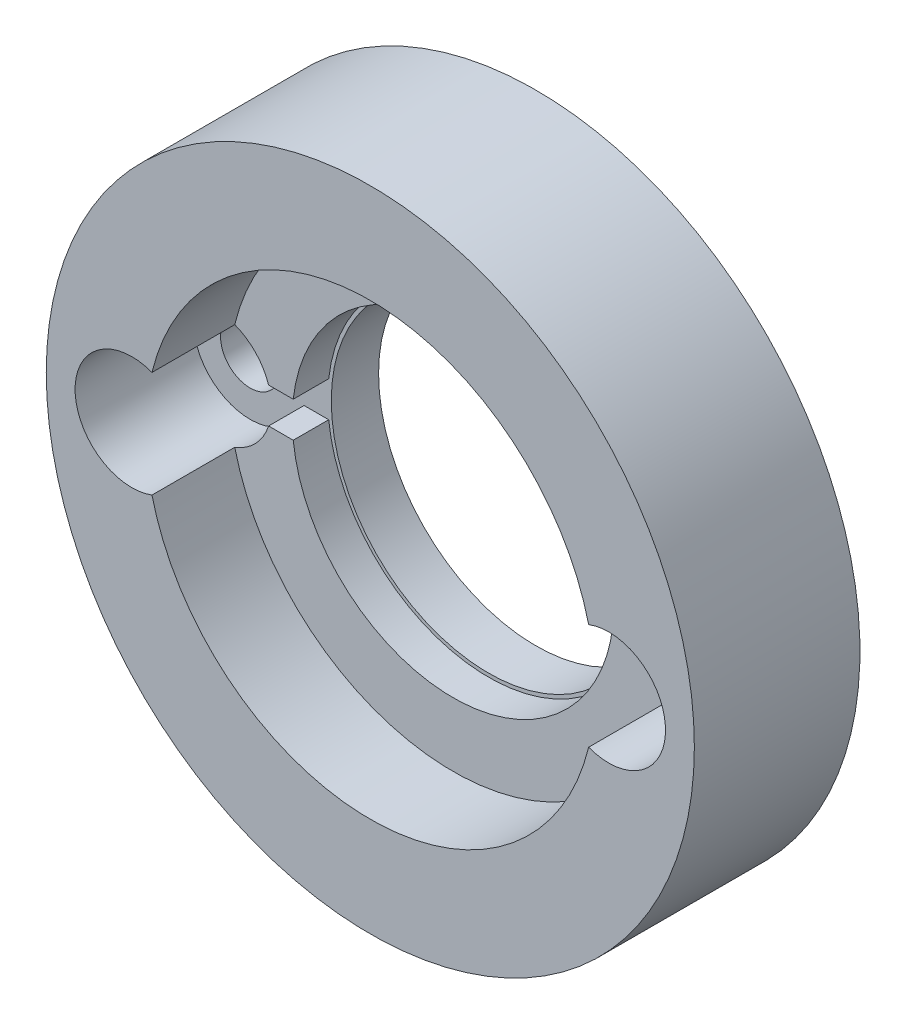
from build123d import *

# Parameters (mm, degrees)
CROQUIS1_R              = 13.7
SALIENTE_EXTRUIR1_DEPTH = 5
CROQUIS2_R              = 9.5
CORTAR_EXTRUIR1_DEPTH   = 3.5
CROQUIS3_R              = 6.8
CORTAR_EXTRUIR2_DEPTH   = 3
SALIENTE_EXTRUIR2_START = 2
CROQUIS4_R              = 13.7
CROQUIS4_R_2            = 6.65
SALIENTE_EXTRUIR2_DEPTH = 2
CROQUIS5_R              = 1.25
CORTAR_EXTRUIR3_DEPTH   = 21.600485431


with BuildPart() as part:
    # Croquis1 → Saliente-Extruir1 (new body)
    with BuildSketch(Plane.XY):
        Circle(CROQUIS1_R)
        with BuildLine():
            Line((0, 0.75), (7.800197377, 0.75))
            ThreePointArc((7.800197377, 0.75), (10.459785271, 2.369760146), (12.48, 0))
            ThreePointArc((12.48, 0), (10.459785271, -2.369760146), (7.800197377, -0.75))
            Line((7.800197377, -0.75), (0, -0.75))
            Line((0, -0.75), (-7.800197377, -0.75))
            ThreePointArc((-7.800197377, -0.75), (-12.48, 0), (-7.800197377, 0.75))
            Line((-7.800197377, 0.75), (0, 0.75))
        make_face(mode=Mode.SUBTRACT)
    extrude(amount=SALIENTE_EXTRUIR1_DEPTH)

    # Croquis2 → Cortar-Extruir1 (cut)
    with BuildSketch(Plane.XY.offset(5)):
        Circle(CROQUIS2_R)
    extrude(amount=-CORTAR_EXTRUIR1_DEPTH, mode=Mode.SUBTRACT)

    # Croquis3 → Cortar-Extruir2 (cut)
    with BuildSketch(Plane.XY.offset(1.5)):
        Circle(CROQUIS3_R)
    extrude(amount=-CORTAR_EXTRUIR2_DEPTH, mode=Mode.SUBTRACT)

    # Croquis4 → Saliente-Extruir2 (add)
    with BuildSketch(Plane(origin=(0, 0, 0), x_dir=(-1, 0, 0), z_dir=(0, 0, -1)).offset(SALIENTE_EXTRUIR2_START)):
        Circle(CROQUIS4_R)
        Circle(CROQUIS4_R_2, mode=Mode.SUBTRACT)
    extrude(amount=-SALIENTE_EXTRUIR2_DEPTH)

    # Croquis5 → Cortar-Extruir3 (cut, through all)
    with BuildSketch(Plane.XY.offset(5)):
        with Locations((-10.08, 0)):
            Circle(CROQUIS5_R)
        with Locations((10.08, 0)):
            Circle(CROQUIS5_R)
    extrude(amount=-CORTAR_EXTRUIR3_DEPTH, mode=Mode.SUBTRACT)


solid = part.part
